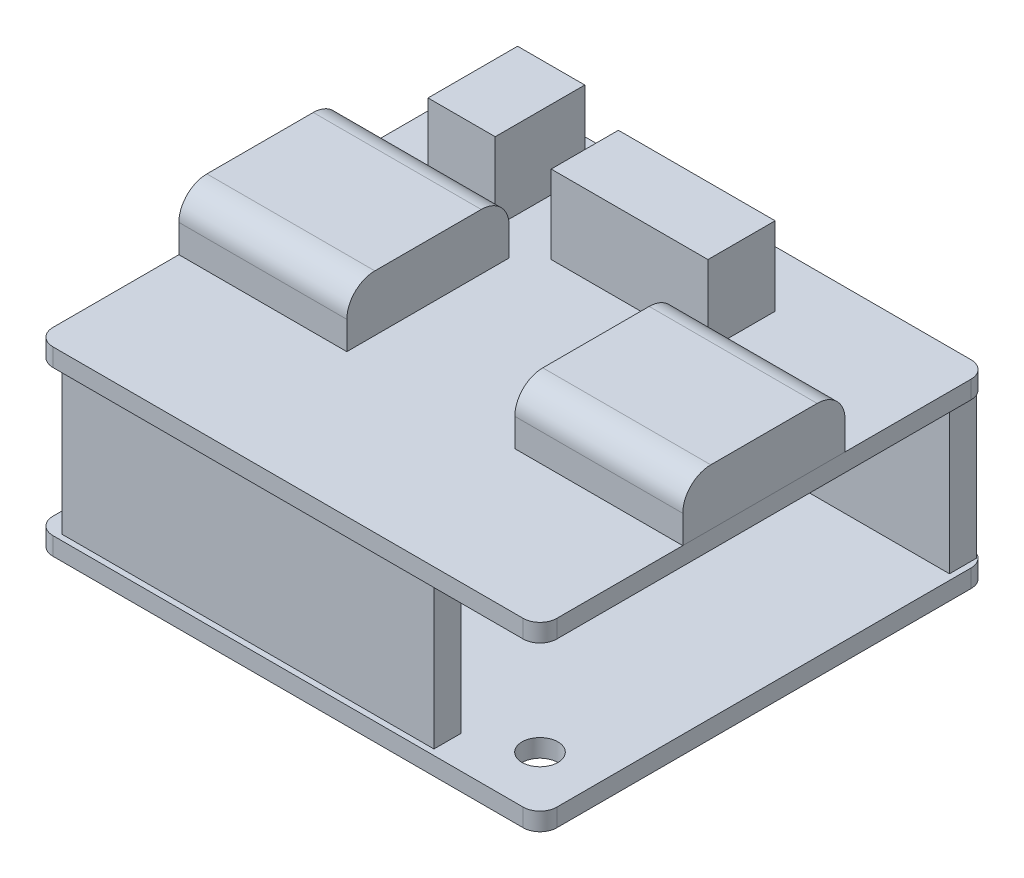
from build123d import *

# Parameters (mm, degrees)
SKETCH1_W           = 45
SKETCH1_H           = 40
BOSS_EXTRUDE1_DEPTH = 1.6
SKETCH2_W           = 25.91
SKETCH2_H           = 2.41
SKETCH2_W_2         = 33.2
BOSS_EXTRUDE2_DEPTH = 13
SKETCH3_W           = 45
SKETCH3_H           = 40
BOSS_EXTRUDE3_DEPTH = 1.6
SKETCH5_W           = 15
SKETCH5_H           = 14.5
BOSS_EXTRUDE5_DEPTH = 5
FILLET1_R           = 2.5
SKETCH7_R           = 1.6
CUT_EXTRUDE1_DEPTH  = 1.6
FILLET2_R           = 1.5
FILLET3_R           = 1.5
SKETCH8_W           = 14
SKETCH8_H           = 6
SKETCH8_W_2         = 6
SKETCH8_H_2         = 8
BOSS_EXTRUDE6_DEPTH = 7
LPATTERN1_COUNT     = 2
LPATTERN1_PITCH     = 30


with BuildPart() as part:
    # Sketch1 → Boss-Extrude1 (new body)
    with BuildSketch(Plane(origin=(0, 0, 0), x_dir=(1, 0, 0), z_dir=(0, 1, 0))):
        Rectangle(SKETCH1_W, SKETCH1_H)
    extrude(amount=BOSS_EXTRUDE1_DEPTH)

    # Sketch2 → Boss-Extrude2 (add)
    with BuildSketch(Plane(origin=(0, 1.6, 0), x_dir=(1, 0, 0), z_dir=(0, 1, 0))):
        with Locations((9.035, 18.285)):
            Rectangle(SKETCH2_W, SKETCH2_H)
        with Locations((-4.08, -18.285)):
            Rectangle(SKETCH2_W_2, SKETCH2_H)
    extrude(amount=BOSS_EXTRUDE2_DEPTH)

    # Sketch3 → Boss-Extrude3 (add)
    with BuildSketch(Plane(origin=(0, 14.6, 0), x_dir=(1, 0, 0), z_dir=(0, 1, 0))):
        Rectangle(SKETCH3_W, SKETCH3_H)
    extrude(amount=BOSS_EXTRUDE3_DEPTH)

    # Sketch7 → Cut-Extrude1 (cut)
    with BuildSketch(Plane(origin=(0, 1.6, 0), x_dir=(1, 0, 0), z_dir=(0, 1, 0))):
        with Locations(Location((17.5, -15, 0), (0, 0, 270))):
            Circle(SKETCH7_R)
        with Locations(Location((-17.5, 15, 0), (0, 0, 270))):
            Circle(SKETCH7_R)
    extrude(amount=-CUT_EXTRUDE1_DEPTH, mode=Mode.SUBTRACT)

    # Fillet2
    fillet2_edges = [part.edges().sort_by_distance(p)[0] for p in [
        (22.5, 0.8, 20),
        (-22.5, 0.8, 20),
        (-22.5, 0.8, -20),
        (22.5, 0.8, -20),
    ]]
    fillet(fillet2_edges, radius=FILLET2_R)

    # Fillet3
    fillet3_edges = [part.edges().sort_by_distance(p)[0] for p in [
        (22.5, 15.4, 20),
        (22.5, 15.4, -20),
        (-22.5, 15.4, -20),
        (-22.5, 15.4, 20),
    ]]
    fillet(fillet3_edges, radius=FILLET3_R)

    # Sketch8 → Boss-Extrude6 (add)
    with BuildSketch(Plane(origin=(0, 16.2, 0), x_dir=(1, 0, 0), z_dir=(0, 1, 0))):
        with Locations((1.5, 12)):
            Rectangle(SKETCH8_W, SKETCH8_H)
        with Locations((-13.5, 13)):
            Rectangle(SKETCH8_W_2, SKETCH8_H_2)
    extrude(amount=BOSS_EXTRUDE6_DEPTH)


with BuildPart() as body_2:
    # Sketch5 → Boss-Extrude5 (new body)
    with BuildSketch(Plane(origin=(0, 16.2, 0), x_dir=(1, 0, 0), z_dir=(0, 1, 0))):
        with Locations((-15, 0)):
            Rectangle(SKETCH5_W, SKETCH5_H)
    extrude(amount=BOSS_EXTRUDE5_DEPTH)

    # Fillet1
    fillet1_edges = [body_2.edges().sort_by_distance(p)[0] for p in [
        (-15, 21.2, -7.25),
        (-15, 21.2, 7.25),
    ]]
    fillet(fillet1_edges, radius=FILLET1_R)


with BuildPart() as lpattern1_1:
    # LPattern1: pattern copy
    add(body_2.part.moved(Location(Vector(1, 0, 0) * (1 * LPATTERN1_PITCH))))


solid = Compound([part.part, body_2.part, lpattern1_1.part])
